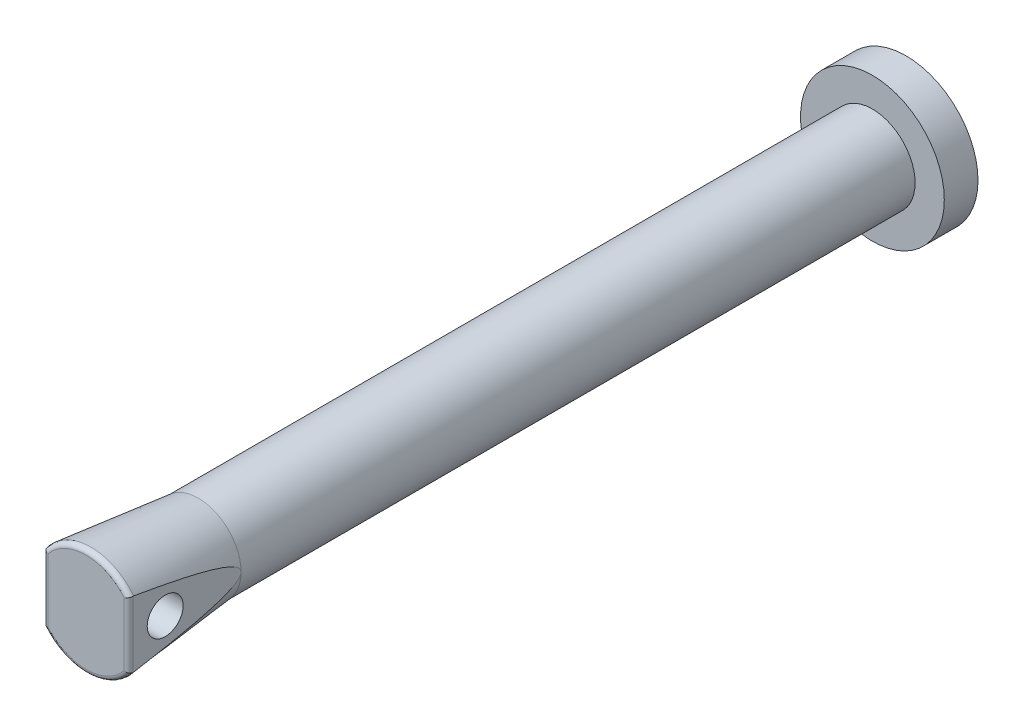
from build123d import *

# Parameters (mm, degrees)
SKETCH_1_R          = 3.2
EXTRUDE_1_DEPTH     = 1.5
SKETCH_2_R          = 1.9
EXTRUDE_2_DEPTH     = 30
SKETCH_4_R          = 1.9
EXTRUDE_3_DEPTH     = 5
EXTRUDE_3_DRAFT     = -6
SKETCH_5_W          = 1.201314004
SKETCH_5_H          = 17.589809259
CUT_EXTRUDE_4_DEPTH = 17.5
SKETCH_6_R          = 0.8
CUT_EXTRUDE_5_DEPTH = 37.993242626
FILLET_1_R          = 0.2


with BuildPart() as part:
    # Эскиз1 → Вытянуть1 (new body)
    with BuildSketch(Plane.XY):
        Circle(SKETCH_1_R)
    extrude(amount=EXTRUDE_1_DEPTH)

    # Эскиз2 → Вытянуть2 (add)
    with BuildSketch(Plane.XY.offset(1.5)):
        Circle(SKETCH_2_R)
    extrude(amount=EXTRUDE_2_DEPTH)


with BuildPart() as extrude_3_tool:
    # Эскиз4 → Вытянуть3 (with draft: the straight prism first)
    with BuildSketch(Plane.XY.offset(31.5)):
        Circle(SKETCH_4_R)
    extrude(amount=EXTRUDE_3_DEPTH)
    # Вытянуть3: the draft: its side faces are tilted about the plane it starts from
    extrude_3_sides = [extrude_3_tool.faces().sort_by_distance(p)[0] for p in [
        (-1.9, 0, 34),
    ]]
    draft(extrude_3_sides, Plane.XY.offset(31.5), EXTRUDE_3_DRAFT)


with BuildPart() as part_1:
    add(part.part)

    # Вытянуть3: add extrude_3_tool
    add(extrude_3_tool.part)

    # Эскиз5 → Вытянуть4 (cut, symmetric)
    with BuildSketch(Plane(origin=(0, 0, 0), x_dir=(1, 0, 0), z_dir=(0, 1, 0))):
        with Locations((2.500657002, -40.29490463)):
            Rectangle(SKETCH_5_W, SKETCH_5_H)
        with Locations((-2.500657002, -40.29490463)):
            Rectangle(SKETCH_5_W, SKETCH_5_H)
    extrude(amount=CUT_EXTRUDE_4_DEPTH, both=True, mode=Mode.SUBTRACT)

    # Эскиз6 → Вытянуть5 (cut, through all)
    with BuildSketch(Plane.ZY.offset(1.9)):
        with Locations((34.877288216, 0)):
            Circle(SKETCH_6_R)
    extrude(amount=-CUT_EXTRUDE_5_DEPTH, mode=Mode.SUBTRACT)

    # Скругление1
    fillet_1_edges = [part_1.edges().sort_by_distance(p)[0] for p in [
        (0, 2.425521176, 36.5),
        (0, -2.425521176, 36.5),
        (1.9, 0, 36.5),
        (-1.9, 0, 36.5),
    ]]
    fillet(fillet_1_edges, radius=FILLET_1_R)


solid = part_1.part
